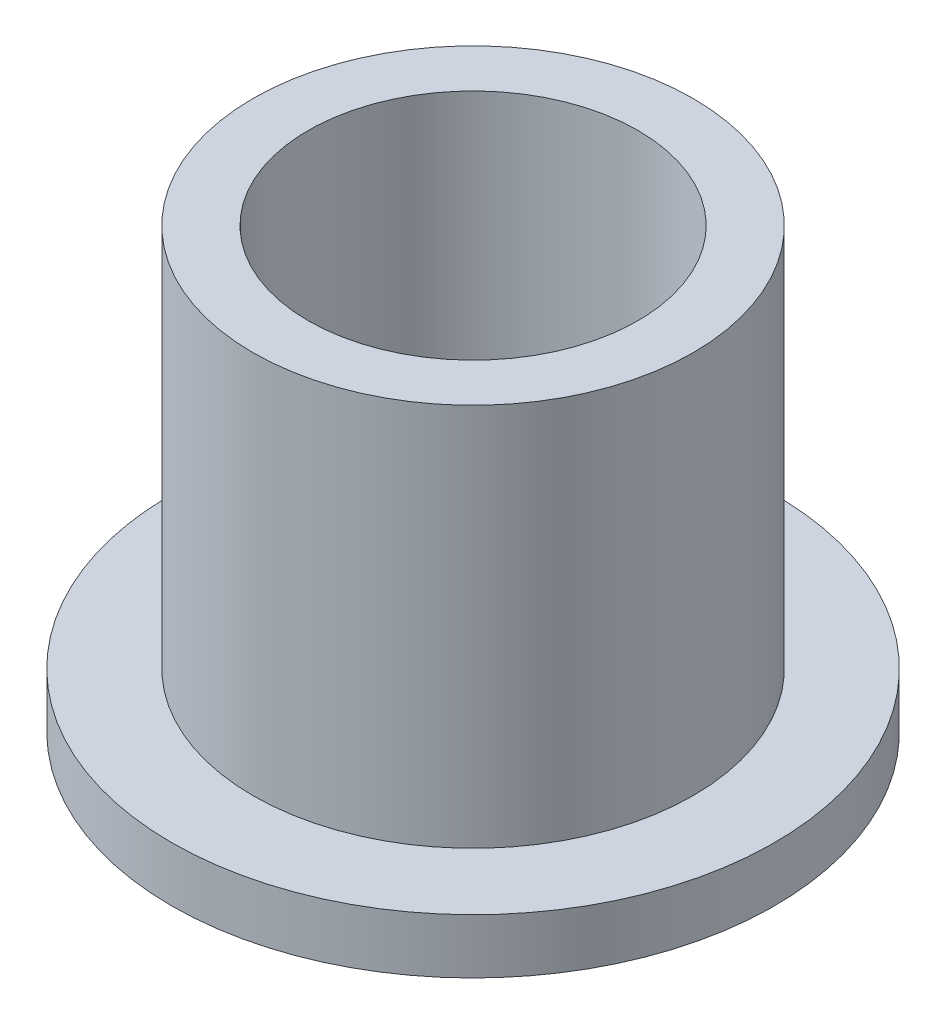
from build123d import *

# Parameters (mm, degrees)
SKETCH2_R           = 6.3754
SKETCH2_R_2         = 4.7752
BOSS_EXTRUDE1_DEPTH = 12.7
SKETCH3_R           = 8.73125
SKETCH3_R_2         = 6.3754
BOSS_EXTRUDE2_DEPTH = 1.5875


with BuildPart() as part:
    # Sketch2 → Boss-Extrude1 (new body)
    with BuildSketch(Plane(origin=(0, 0, 0), x_dir=(1, 0, 0), z_dir=(0, 1, 0))):
        with Locations(Location((0, 0, 0), (0, 0, 270))):
            Circle(SKETCH2_R)
        with Locations(Location((0, 0, 0), (0, 0, 270))):
            Circle(SKETCH2_R_2, mode=Mode.SUBTRACT)
    extrude(amount=BOSS_EXTRUDE1_DEPTH)

    # Sketch3 → Boss-Extrude2 (add)
    with BuildSketch(Plane(origin=(0, 0, 0), x_dir=(1, 0, 0), z_dir=(0, 1, 0))):
        with Locations(Location((0, 0, 0), (0, 0, 270))):
            Circle(SKETCH3_R)
        with Locations(Location((0, 0, 0), (0, 0, 270))):
            Circle(SKETCH3_R_2, mode=Mode.SUBTRACT)
    extrude(amount=BOSS_EXTRUDE2_DEPTH)


solid = part.part
